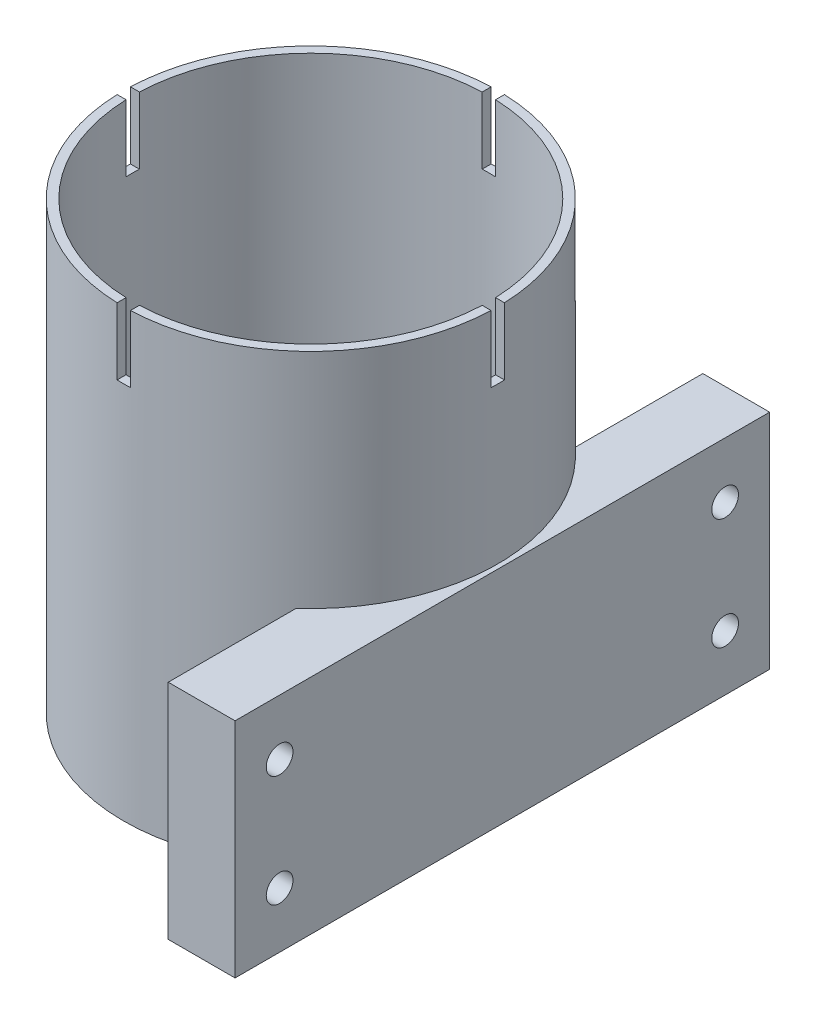
from build123d import *

# Parameters (mm, degrees)
ESBO_O1_R                = 42
RESSALTO_EXTRUS_O1_DEPTH = 100
ESBO_O2_R                = 40
CORTE_EXTRUS_O1_DEPTH    = 98
ESBO_O3_R                = 5.5
CORTE_EXTRUS_O2_DEPTH    = 117.309930788
ESBO_O4_R                = 10
CORTE_EXTRUS_O3_DEPTH    = 117.309930788
CORTE_EXTRUS_O4_DEPTH    = 15
RESSALTO_EXTRUS_O3_DEPTH = 50
ESBO_O9_R                = 3
CORTE_EXTRUS_O5_DEPTH    = 137.014705087


with BuildPart() as part:
    # Esboço1 → Ressalto-extrusão1 (new body)
    with BuildSketch(Plane(origin=(0, 0, 0), x_dir=(1, 0, 0), z_dir=(0, 1, 0))):
        with Locations(Location((0, 0, 0), (0, 0, 270))):
            Circle(ESBO_O1_R)
    extrude(amount=RESSALTO_EXTRUS_O1_DEPTH)

    # Esboço2 → Corte-extrusão1 (cut)
    with BuildSketch(Plane(origin=(0, 100, 0), x_dir=(1, 0, 0), z_dir=(0, 1, 0))):
        with Locations(Location((0, 0, 0), (0, 0, 270))):
            Circle(ESBO_O2_R)
    extrude(amount=-CORTE_EXTRUS_O1_DEPTH, mode=Mode.SUBTRACT)

    # Esboço3 → Corte-extrusão2 (cut, through all)
    with BuildSketch(Plane.XZ):
        with Locations(Location((0, 30, 0), (0, 0, 270))):
            Circle(ESBO_O3_R)
    extrude(amount=-CORTE_EXTRUS_O2_DEPTH, mode=Mode.SUBTRACT)

    # Esboço4 → Corte-extrusão3 (cut, through all)
    with BuildSketch(Plane.XZ):
        with Locations(Location((0, 0, 0), (0, 0, 270))):
            Circle(ESBO_O4_R)
    extrude(amount=-CORTE_EXTRUS_O3_DEPTH, mode=Mode.SUBTRACT)

    # Esboço5 → Corte-extrusão4 (cut)
    with BuildSketch(Plane(origin=(0, 100, 0), x_dir=(1, 0, 0), z_dir=(0, 1, 0))):
        Polygon((1.5, 1.5), (52.94033898, 1.5), (52.94033898, -1.5), (1.5, -1.5), (1.5, -46.298898587), (-1.5, -46.298898587), (-1.5, -1.5), (-52.94033898, -1.5), (-52.94033898, 1.5), (-1.5, 1.5), (-1.5, 46.298898587), (1.5, 46.298898587), align=None)
    extrude(amount=-CORTE_EXTRUS_O4_DEPTH, mode=Mode.SUBTRACT)

    # Esboço8 → Ressalto-extrusão3 (add)
    with BuildSketch(Plane.XZ):
        with BuildLine():
            Line((28, 31.304951685), (28, 60))
            Line((28, 60), (43, 60))
            Line((43, 60), (43, -60))
            Line((43, -60), (28, -60))
            Line((28, -60), (28, -31.304951685))
            ThreePointArc((28, -31.304951685), (42, 0), (28, 31.304951685))
        make_face()
    extrude(amount=-RESSALTO_EXTRUS_O3_DEPTH)

    # Esboço9 → Corte-extrusão5 (cut, through all)
    with BuildSketch(Plane.ZY.offset(-28)):
        with Locations((50, 37.5)):
            Circle(ESBO_O9_R)
        with Locations((50, 12.5)):
            Circle(ESBO_O9_R)
        with Locations(Location((-50, 12.5, 0), (0, 0, 180))):
            Circle(ESBO_O9_R)
        with Locations(Location((-50, 37.5, 0), (0, 0, 180))):
            Circle(ESBO_O9_R)
    extrude(amount=-CORTE_EXTRUS_O5_DEPTH, mode=Mode.SUBTRACT)


solid = part.part
